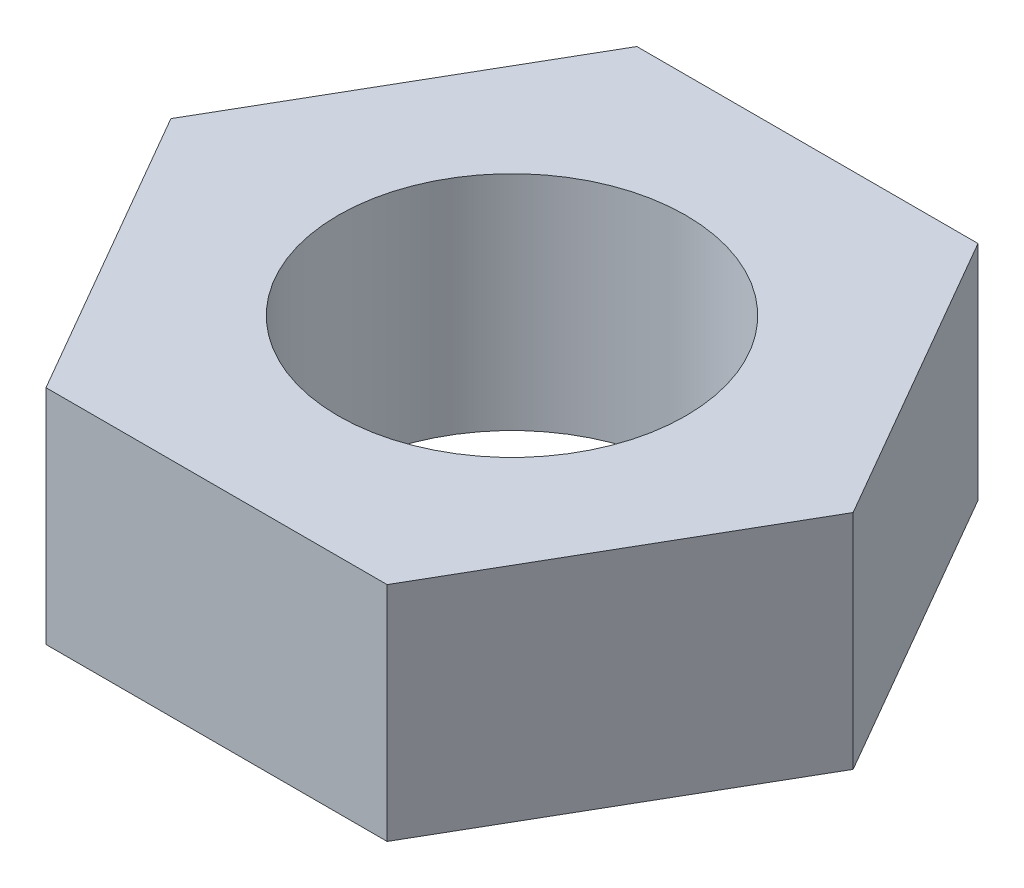
from build123d import *

# Parameters (mm, degrees)
SKETCH1_R           = 5
BOSS_EXTRUDE1_DEPTH = 3.2


with BuildPart() as part:
    # Sketch1 → Boss-Extrude1 (new, symmetric)
    with BuildSketch(Plane(origin=(0, 0, 0), x_dir=(1, 0, 0), z_dir=(0, 1, 0))):
        Polygon((4.907477288, 8.5), (-4.907477288, 8.5), (-9.814954576, 0), (-4.907477288, -8.5), (4.907477288, -8.5), (9.814954576, 0), align=None)
        with Locations(Location((0, 0, 0), (0, 0, 270))):
            Circle(SKETCH1_R, mode=Mode.SUBTRACT)
    extrude(amount=BOSS_EXTRUDE1_DEPTH, both=True)


solid = part.part
